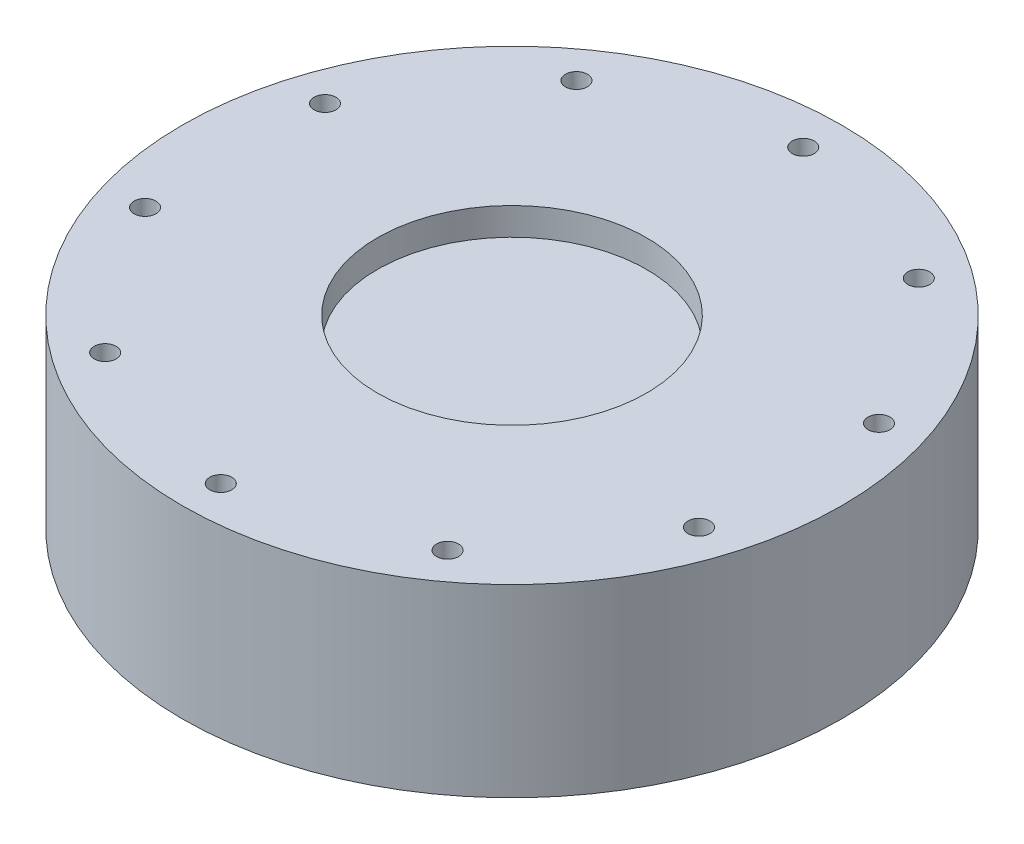
from build123d import *

# Parameters (mm, degrees)
SKETCH1_R               = 60
BOSS_EXTRUDE1_DEPTH     = 33.6
CUT_EXTRUDE2_DEPTH      = 92.263136041
CUT_EXTRUDE2_DEPTH_BACK = 92.263136041
SKETCH2_R               = 2
SKETCH4_R               = 24.5
CUT_EXTRUDE3_DEPTH      = 5
SKETCH5_R               = 42.5
BOSS_EXTRUDE2_DEPTH     = 11.5
CUT_EXTRUDE4_DEPTH      = 97.093756301
CUT_EXTRUDE4_DEPTH_BACK = 11.5


with BuildPart() as part:
    # Sketch1 → Boss-Extrude1 (new body)
    with BuildSketch(Plane(origin=(0, 0, 0), x_dir=(1, 0, 0), z_dir=(0, 1, 0))):
        with Locations(Location((0, 0, 0), (0, 0, 270))):
            Circle(SKETCH1_R)
    extrude(amount=BOSS_EXTRUDE1_DEPTH)

    # Sketch2 → Cut-Extrude2 (cut, two sides: drawn at the far end of the back side and taken through both)
    with BuildSketch(Plane(origin=(0, 33.6, 0), x_dir=(1, 0, 0), z_dir=(0, 1, 0)).offset(-CUT_EXTRUDE2_DEPTH_BACK)):
        with Locations(Location((0, 53, 0), (0, 0, 270))):
            Circle(SKETCH2_R)
        with Locations(Location((31.152618372, 42.877900702, 0), (0, 0, 270))):
            Circle(SKETCH2_R)
        with Locations(Location((50.405995364, 16.377900702, 0), (0, 0, 270))):
            Circle(SKETCH2_R)
        with Locations(Location((50.405995364, -16.377900702, 0), (0, 0, 270))):
            Circle(SKETCH2_R)
        with Locations(Location((31.152618372, -42.877900702, 0), (0, 0, 270))):
            Circle(SKETCH2_R)
        with Locations(Location((0, -53, 0), (0, 0, 270))):
            Circle(SKETCH2_R)
        with Locations(Location((-31.152618372, -42.877900702, 0), (0, 0, 270))):
            Circle(SKETCH2_R)
        with Locations(Location((-50.405995364, -16.377900702, 0), (0, 0, 270))):
            Circle(SKETCH2_R)
        with Locations(Location((-50.405995364, 16.377900702, 0), (0, 0, 270))):
            Circle(SKETCH2_R)
        with Locations(Location((-31.152618372, 42.877900702, 0), (0, 0, 270))):
            Circle(SKETCH2_R)
    extrude(amount=CUT_EXTRUDE2_DEPTH + CUT_EXTRUDE2_DEPTH_BACK, mode=Mode.SUBTRACT)

    # Sketch4 → Cut-Extrude3 (cut)
    with BuildSketch(Plane(origin=(0, 33.6, 0), x_dir=(1, 0, 0), z_dir=(0, 1, 0))):
        with Locations(Location((0, 0, 0), (0, 0, 270))):
            Circle(SKETCH4_R)
    extrude(amount=-CUT_EXTRUDE3_DEPTH, mode=Mode.SUBTRACT)

    # Sketch5 → Boss-Extrude2 (add)
    with BuildSketch(Plane.XZ):
        with Locations(Location((0, 0, 0), (0, 0, 90))):
            Circle(SKETCH5_R)
    extrude(amount=BOSS_EXTRUDE2_DEPTH)

    # Sketch6 → Cut-Extrude4 (cut, two sides: drawn at the far end of the back side and taken through both)
    with BuildSketch(Plane.XZ.offset(11.5).offset(-CUT_EXTRUDE4_DEPTH_BACK)):
        with BuildLine():
            Line((14.2, -40.057583552), (-14.2, -40.057583552))
            ThreePointArc((-14.2, -40.057583552), (0, -42.5), (14.2, -40.057583552))
        make_face()
    extrude(amount=CUT_EXTRUDE4_DEPTH + CUT_EXTRUDE4_DEPTH_BACK, mode=Mode.SUBTRACT)


solid = part.part
